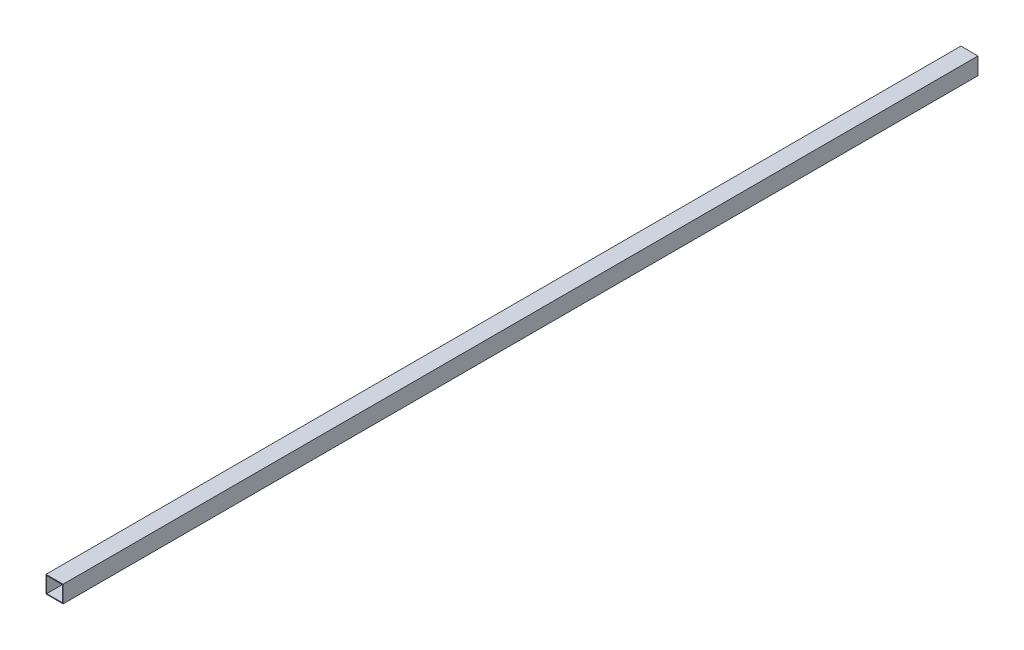
from build123d import *

# Parameters (mm, degrees)
SKETCH2_W           = 38.1
SKETCH2_H           = 38.1
SKETCH2_W_2         = 34.925
SKETCH2_H_2         = 34.925
BOSS_EXTRUDE1_DEPTH = 2038.35


with BuildPart() as part:
    # Sketch2 → Boss-Extrude1 (new body)
    with BuildSketch(Plane.XY):
        with Locations((19.05, 19.05)):
            Rectangle(SKETCH2_W, SKETCH2_H)
        with Locations((19.05, 19.05)):
            Rectangle(SKETCH2_W_2, SKETCH2_H_2, mode=Mode.SUBTRACT)
    extrude(amount=BOSS_EXTRUDE1_DEPTH)


solid = part.part
